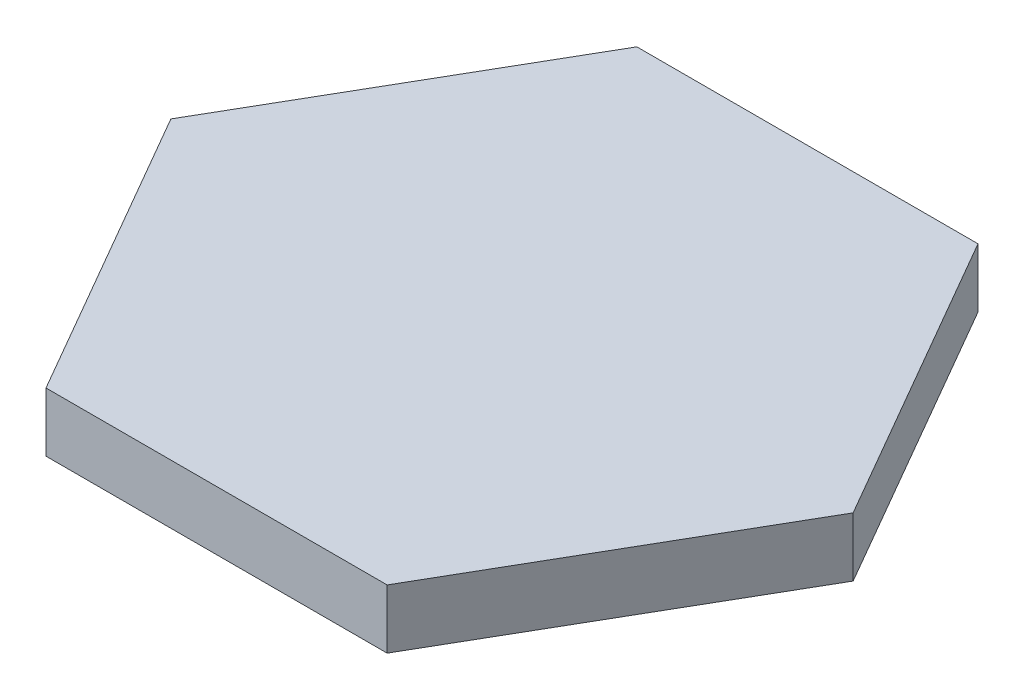
from build123d import *

# Parameters (mm, degrees)
BOSS_EXTRUDE1_DEPTH = 5


with BuildPart() as part:
    # Sketch1 → Boss-Extrude1 (new body)
    with BuildSketch(Plane(origin=(0, 0, 0), x_dir=(1, 0, 0), z_dir=(0, 1, 0))):
        Polygon((14.43375673, -25), (28.867513459, 0), (14.43375673, 25), (-14.43375673, 25), (-28.867513459, 0), (-14.43375673, -25), align=None)
    extrude(amount=BOSS_EXTRUDE1_DEPTH)


solid = part.part
